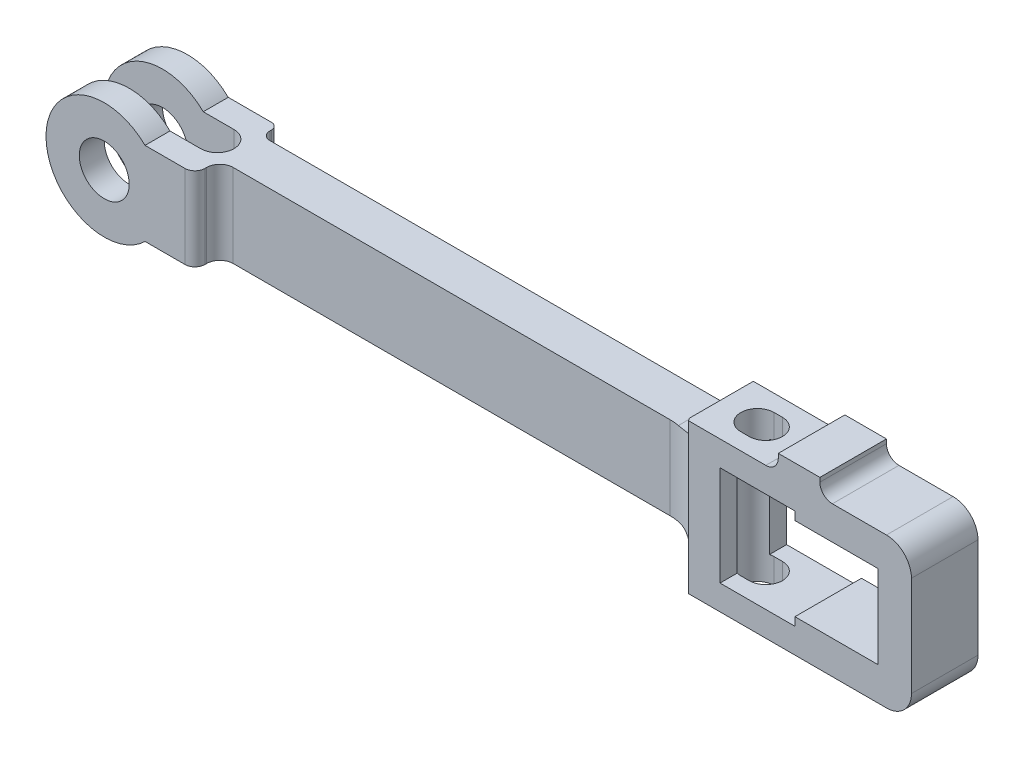
from build123d import *

# Parameters (mm, degrees)
ESQUISSE1_R                  = 3.5
ESQUISSE1_R_2                = 1.5
BOSS_EXTRU_1_DEPTH           = 5
ENL_V_MAT_EXTRU_2_DEPTH      = 50.256979201
ENL_V_MAT_EXTRU_2_DEPTH_BACK = 50.256979201
ENL_V_MAT_EXTRU_3_DEPTH      = 50.580742257
ENL_V_MAT_EXTRU_3_DEPTH_BACK = 50.580742257


with BuildPart() as part:
    # Esquisse1 → Boss.-Extru.1 (new body)
    # profile 1 of 2: a face of its own
    with BuildSketch(Plane.XY):
        Circle(ESQUISSE1_R)
        Circle(ESQUISSE1_R_2, mode=Mode.SUBTRACT)
    # profile 2 of 2: a face of its own
    with BuildSketch(Plane.XY):
        with BuildLine():
            Line((33.05, 2.5), (3.5, 2.5))
            Line((3.5, 2.5), (2.449489743, 2.5))
            ThreePointArc((2.449489743, 2.5), (3.226702194, 1.355873501), (3.5, 0))
            ThreePointArc((3.5, 0), (3.226702194, -1.355873501), (2.449489743, -2.5))
            Line((2.449489743, -2.5), (3.5, -2.5))
            Line((3.5, -2.5), (33.05, -2.5))
            ThreePointArc((33.05, -2.5), (34.428858223, -3.071141777), (35, -4.45))
            Line((35, -4.45), (35, -4.5))
            Line((35, -4.5), (47, -4.5))
            ThreePointArc((47, -4.5), (48.060660172, -4.060660172), (48.5, -3))
            Line((48.5, -3), (48.5, 3))
            ThreePointArc((48.5, 3), (48.060660172, 4.060660172), (47, 4.5))
            Line((47, 4.5), (43.75, 4.5))
            ThreePointArc((43.75, 4.5), (43.219669914, 4.719669914), (43, 5.25))
            Line((43, 5.25), (43, 5.5))
            Line((43, 5.5), (40.5, 5.5))
            Line((40.5, 5.5), (40.5, 5.25))
            ThreePointArc((40.5, 5.25), (40.280330086, 4.719669914), (39.75, 4.5))
            Line((39.75, 4.5), (35, 4.5))
            Line((35, 4.5), (35, 4.45))
            ThreePointArc((35, 4.45), (34.428858223, 3.071141777), (33.05, 2.5))
        make_face()
        Polygon((41.5, -3), (37, -3), (37, 3), (41.5, 3), (41.5, 2.5), (46.5, 2.5), (46.5, -2.5), (41.5, -2.5), align=None, mode=Mode.SUBTRACT)
    extrude(amount=BOSS_EXTRU_1_DEPTH)

    # Esquisse2 → Enlèv. mat.-Extru.2 (cut, two sides: drawn at the far end of the back side and taken through both)
    with BuildSketch(Plane(origin=(0, 2.5, 0), x_dir=(1, 0, 0), z_dir=(0, 1, 0)).offset(-ENL_V_MAT_EXTRU_2_DEPTH_BACK)):
        with BuildLine():
            ThreePointArc((5.449489743, -0.5), (5.595936352, -0.853553391), (5.949489743, -1))
            Line((5.949489743, -1), (48.5, -1))
            Line((48.5, -1), (48.5, 0))
            Line((48.5, 0), (5.049489743, 0))
            ThreePointArc((5.049489743, 0), (5.332332455, -0.117157288), (5.449489743, -0.4))
            Line((5.449489743, -0.4), (5.449489743, -0.5))
        make_face()
        with BuildLine():
            Line((4.849489662, -5), (35.098076211, -5))
            ThreePointArc((35.098076211, -5), (34, -3.901923789), (32.5, -3.5))
            Line((32.5, -3.5), (6.249489662, -3.5))
            ThreePointArc((6.249489662, -3.5), (5.683804237, -3.734314575), (5.449489662, -4.3))
            Line((5.449489662, -4.3), (5.449489662, -4.4))
            ThreePointArc((5.449489662, -4.4), (5.27375373, -4.824264069), (4.849489662, -5))
        make_face()
        with BuildLine():
            Line((4.295064523, -1.5), (-3.5, -1.5))
            Line((-3.5, -1.5), (-3.5, -3.5))
            Line((-3.5, -3.5), (4.295064523, -3.5))
            ThreePointArc((4.295064523, -3.5), (5.295064523, -2.5), (4.295064523, -1.5))
        make_face()
    extrude(amount=ENL_V_MAT_EXTRU_2_DEPTH + ENL_V_MAT_EXTRU_2_DEPTH_BACK, mode=Mode.SUBTRACT)

    # Esquisse3 → Enlèv. mat.-Extru.3 (cut, two sides: drawn at the far end of the back side and taken through both)
    with BuildSketch(Plane(origin=(0, 4.5, 0), x_dir=(1, 0, 0), z_dir=(0, 1, 0)).offset(-ENL_V_MAT_EXTRU_3_DEPTH_BACK)):
        with BuildLine():
            Line((37.750303976, -4), (37.250303976, -4))
            ThreePointArc((37.250303976, -4), (36.250303976, -3), (37.250303976, -2))
            Line((37.250303976, -2), (37.750303976, -2))
            ThreePointArc((37.750303976, -2), (38.750303976, -3), (37.750303976, -4))
        make_face()
    extrude(amount=ENL_V_MAT_EXTRU_3_DEPTH + ENL_V_MAT_EXTRU_3_DEPTH_BACK, mode=Mode.SUBTRACT)


solid = part.part
